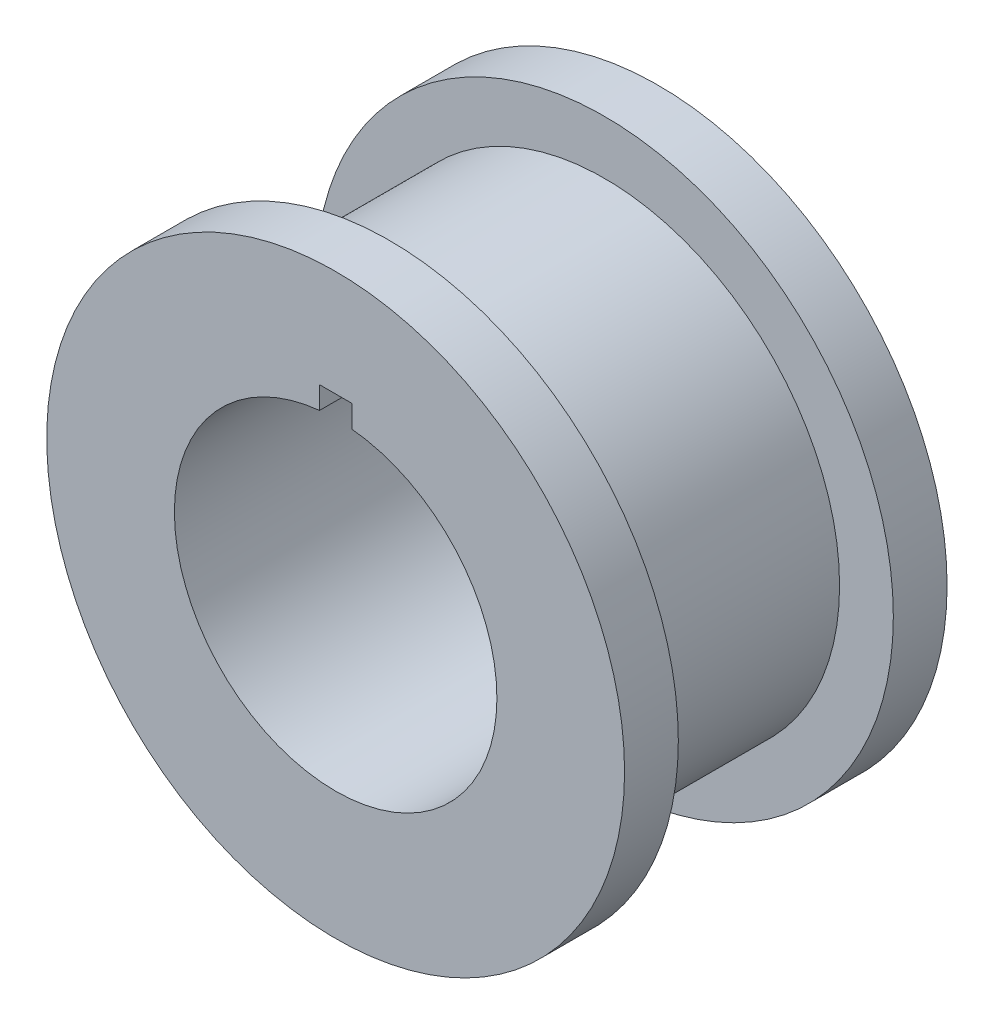
from build123d import *

# Parameters (mm, degrees)
SKETCH_1_R               = 21.875
EXTRUDE_1_DEPTH          = 15
PATTERN_CIRCULAR_1_COUNT = 20
SKETCH_3_R               = 15
CUT_EXTRUDE_1_DEPTH      = 44.09328544
CUT_EXTRUDE_4_DEPTH      = 35.380681349
CUT_EXTRUDE_4_DEPTH_BACK = 35.380681349
SKETCH_6_W               = 3
SKETCH_6_H               = 17
SKETCH_7_R               = 26.875
SKETCH_7_R_2             = 21.875
EXTRUDE_2_DEPTH          = 5


with BuildPart() as part:
    # 草图1 → 凸台-拉伸1 (new, symmetric)
    with BuildSketch(Plane.XY):
        Circle(SKETCH_1_R)
    extrude(amount=EXTRUDE_1_DEPTH, both=True)


with BuildPart() as pattern_circular_1_1:
    # 阵列(圆周)1: pattern copy
    add(part.part.rotate(Axis((0, 0, 15), (0, 0, 1)), 1 * 360 / PATTERN_CIRCULAR_1_COUNT))


with BuildPart() as pattern_circular_1_2:
    # 阵列(圆周)1: pattern copy
    add(part.part.rotate(Axis((0, 0, 15), (0, 0, 1)), 2 * 360 / PATTERN_CIRCULAR_1_COUNT))


with BuildPart() as pattern_circular_1_3:
    # 阵列(圆周)1: pattern copy
    add(part.part.rotate(Axis((0, 0, 15), (0, 0, 1)), 3 * 360 / PATTERN_CIRCULAR_1_COUNT))


with BuildPart() as pattern_circular_1_4:
    # 阵列(圆周)1: pattern copy
    add(part.part.rotate(Axis((0, 0, 15), (0, 0, 1)), 4 * 360 / PATTERN_CIRCULAR_1_COUNT))


with BuildPart() as pattern_circular_1_5:
    # 阵列(圆周)1: pattern copy
    add(part.part.rotate(Axis((0, 0, 15), (0, 0, 1)), 5 * 360 / PATTERN_CIRCULAR_1_COUNT))


with BuildPart() as pattern_circular_1_6:
    # 阵列(圆周)1: pattern copy
    add(part.part.rotate(Axis((0, 0, 15), (0, 0, 1)), 6 * 360 / PATTERN_CIRCULAR_1_COUNT))


with BuildPart() as pattern_circular_1_7:
    # 阵列(圆周)1: pattern copy
    add(part.part.rotate(Axis((0, 0, 15), (0, 0, 1)), 7 * 360 / PATTERN_CIRCULAR_1_COUNT))


with BuildPart() as pattern_circular_1_8:
    # 阵列(圆周)1: pattern copy
    add(part.part.rotate(Axis((0, 0, 15), (0, 0, 1)), 8 * 360 / PATTERN_CIRCULAR_1_COUNT))


with BuildPart() as pattern_circular_1_9:
    # 阵列(圆周)1: pattern copy
    add(part.part.rotate(Axis((0, 0, 15), (0, 0, 1)), 9 * 360 / PATTERN_CIRCULAR_1_COUNT))


with BuildPart() as pattern_circular_1_10:
    # 阵列(圆周)1: pattern copy
    add(part.part.rotate(Axis((0, 0, 15), (0, 0, 1)), 10 * 360 / PATTERN_CIRCULAR_1_COUNT))


with BuildPart() as pattern_circular_1_11:
    # 阵列(圆周)1: pattern copy
    add(part.part.rotate(Axis((0, 0, 15), (0, 0, 1)), 11 * 360 / PATTERN_CIRCULAR_1_COUNT))


with BuildPart() as pattern_circular_1_12:
    # 阵列(圆周)1: pattern copy
    add(part.part.rotate(Axis((0, 0, 15), (0, 0, 1)), 12 * 360 / PATTERN_CIRCULAR_1_COUNT))


with BuildPart() as pattern_circular_1_13:
    # 阵列(圆周)1: pattern copy
    add(part.part.rotate(Axis((0, 0, 15), (0, 0, 1)), 13 * 360 / PATTERN_CIRCULAR_1_COUNT))


with BuildPart() as pattern_circular_1_14:
    # 阵列(圆周)1: pattern copy
    add(part.part.rotate(Axis((0, 0, 15), (0, 0, 1)), 14 * 360 / PATTERN_CIRCULAR_1_COUNT))


with BuildPart() as pattern_circular_1_15:
    # 阵列(圆周)1: pattern copy
    add(part.part.rotate(Axis((0, 0, 15), (0, 0, 1)), 15 * 360 / PATTERN_CIRCULAR_1_COUNT))


with BuildPart() as pattern_circular_1_16:
    # 阵列(圆周)1: pattern copy
    add(part.part.rotate(Axis((0, 0, 15), (0, 0, 1)), 16 * 360 / PATTERN_CIRCULAR_1_COUNT))


with BuildPart() as pattern_circular_1_17:
    # 阵列(圆周)1: pattern copy
    add(part.part.rotate(Axis((0, 0, 15), (0, 0, 1)), 17 * 360 / PATTERN_CIRCULAR_1_COUNT))


with BuildPart() as pattern_circular_1_18:
    # 阵列(圆周)1: pattern copy
    add(part.part.rotate(Axis((0, 0, 15), (0, 0, 1)), 18 * 360 / PATTERN_CIRCULAR_1_COUNT))


with BuildPart() as pattern_circular_1_19:
    # 阵列(圆周)1: pattern copy
    add(part.part.rotate(Axis((0, 0, 15), (0, 0, 1)), 19 * 360 / PATTERN_CIRCULAR_1_COUNT))


with BuildPart() as cut_extrude_1_tool:
    # 草图3 → 切除-拉伸1 (new, through all)
    with BuildSketch(Plane.XY.offset(15)):
        Circle(SKETCH_3_R)
    extrude(amount=-CUT_EXTRUDE_1_DEPTH)


with BuildPart() as part_1:
    add(part.part)

    # 切除-拉伸1: cut by cut_extrude_1_tool
    add(cut_extrude_1_tool.part, mode=Mode.SUBTRACT)


with BuildPart() as pattern_circular_1_1_1:
    add(pattern_circular_1_1.part)

    # 切除-拉伸1: cut by cut_extrude_1_tool
    add(cut_extrude_1_tool.part, mode=Mode.SUBTRACT)


with BuildPart() as pattern_circular_1_2_1:
    add(pattern_circular_1_2.part)

    # 切除-拉伸1: cut by cut_extrude_1_tool
    add(cut_extrude_1_tool.part, mode=Mode.SUBTRACT)


with BuildPart() as pattern_circular_1_3_1:
    add(pattern_circular_1_3.part)

    # 切除-拉伸1: cut by cut_extrude_1_tool
    add(cut_extrude_1_tool.part, mode=Mode.SUBTRACT)


with BuildPart() as pattern_circular_1_4_1:
    add(pattern_circular_1_4.part)

    # 切除-拉伸1: cut by cut_extrude_1_tool
    add(cut_extrude_1_tool.part, mode=Mode.SUBTRACT)


with BuildPart() as pattern_circular_1_5_1:
    add(pattern_circular_1_5.part)

    # 切除-拉伸1: cut by cut_extrude_1_tool
    add(cut_extrude_1_tool.part, mode=Mode.SUBTRACT)


with BuildPart() as pattern_circular_1_6_1:
    add(pattern_circular_1_6.part)

    # 切除-拉伸1: cut by cut_extrude_1_tool
    add(cut_extrude_1_tool.part, mode=Mode.SUBTRACT)


with BuildPart() as pattern_circular_1_7_1:
    add(pattern_circular_1_7.part)

    # 切除-拉伸1: cut by cut_extrude_1_tool
    add(cut_extrude_1_tool.part, mode=Mode.SUBTRACT)


with BuildPart() as pattern_circular_1_8_1:
    add(pattern_circular_1_8.part)

    # 切除-拉伸1: cut by cut_extrude_1_tool
    add(cut_extrude_1_tool.part, mode=Mode.SUBTRACT)


with BuildPart() as pattern_circular_1_9_1:
    add(pattern_circular_1_9.part)

    # 切除-拉伸1: cut by cut_extrude_1_tool
    add(cut_extrude_1_tool.part, mode=Mode.SUBTRACT)


with BuildPart() as pattern_circular_1_10_1:
    add(pattern_circular_1_10.part)

    # 切除-拉伸1: cut by cut_extrude_1_tool
    add(cut_extrude_1_tool.part, mode=Mode.SUBTRACT)


with BuildPart() as pattern_circular_1_11_1:
    add(pattern_circular_1_11.part)

    # 切除-拉伸1: cut by cut_extrude_1_tool
    add(cut_extrude_1_tool.part, mode=Mode.SUBTRACT)


with BuildPart() as pattern_circular_1_12_1:
    add(pattern_circular_1_12.part)

    # 切除-拉伸1: cut by cut_extrude_1_tool
    add(cut_extrude_1_tool.part, mode=Mode.SUBTRACT)


with BuildPart() as pattern_circular_1_13_1:
    add(pattern_circular_1_13.part)

    # 切除-拉伸1: cut by cut_extrude_1_tool
    add(cut_extrude_1_tool.part, mode=Mode.SUBTRACT)


with BuildPart() as pattern_circular_1_14_1:
    add(pattern_circular_1_14.part)

    # 切除-拉伸1: cut by cut_extrude_1_tool
    add(cut_extrude_1_tool.part, mode=Mode.SUBTRACT)


with BuildPart() as pattern_circular_1_15_1:
    add(pattern_circular_1_15.part)

    # 切除-拉伸1: cut by cut_extrude_1_tool
    add(cut_extrude_1_tool.part, mode=Mode.SUBTRACT)


with BuildPart() as pattern_circular_1_16_1:
    add(pattern_circular_1_16.part)

    # 切除-拉伸1: cut by cut_extrude_1_tool
    add(cut_extrude_1_tool.part, mode=Mode.SUBTRACT)


with BuildPart() as pattern_circular_1_17_1:
    add(pattern_circular_1_17.part)

    # 切除-拉伸1: cut by cut_extrude_1_tool
    add(cut_extrude_1_tool.part, mode=Mode.SUBTRACT)


with BuildPart() as pattern_circular_1_18_1:
    add(pattern_circular_1_18.part)

    # 切除-拉伸1: cut by cut_extrude_1_tool
    add(cut_extrude_1_tool.part, mode=Mode.SUBTRACT)


with BuildPart() as pattern_circular_1_19_1:
    add(pattern_circular_1_19.part)

    # 切除-拉伸1: cut by cut_extrude_1_tool
    add(cut_extrude_1_tool.part, mode=Mode.SUBTRACT)


with BuildPart() as cut_extrude_4_tool:
    # 草图6 → 切除-拉伸4 (new, two sides: drawn at the far end of the back side and taken through both)
    with BuildSketch(Plane.XY.offset(-CUT_EXTRUDE_4_DEPTH_BACK)):
        with Locations((0, 8.5)):
            Rectangle(SKETCH_6_W, SKETCH_6_H)
    extrude(amount=CUT_EXTRUDE_4_DEPTH + CUT_EXTRUDE_4_DEPTH_BACK)


with BuildPart() as part_2:
    add(part_1.part)

    # 切除-拉伸4: cut by cut_extrude_4_tool
    add(cut_extrude_4_tool.part, mode=Mode.SUBTRACT)



with BuildPart() as pattern_circular_1_1_2:
    add(pattern_circular_1_1_1.part)

    # 切除-拉伸4: cut by cut_extrude_4_tool
    add(cut_extrude_4_tool.part, mode=Mode.SUBTRACT)


with BuildPart() as pattern_circular_1_2_2:
    add(pattern_circular_1_2_1.part)

    # 切除-拉伸4: cut by cut_extrude_4_tool
    add(cut_extrude_4_tool.part, mode=Mode.SUBTRACT)


with BuildPart() as pattern_circular_1_3_2:
    add(pattern_circular_1_3_1.part)

    # 切除-拉伸4: cut by cut_extrude_4_tool
    add(cut_extrude_4_tool.part, mode=Mode.SUBTRACT)


with BuildPart() as pattern_circular_1_4_2:
    add(pattern_circular_1_4_1.part)

    # 切除-拉伸4: cut by cut_extrude_4_tool
    add(cut_extrude_4_tool.part, mode=Mode.SUBTRACT)


with BuildPart() as pattern_circular_1_5_2:
    add(pattern_circular_1_5_1.part)

    # 切除-拉伸4: cut by cut_extrude_4_tool
    add(cut_extrude_4_tool.part, mode=Mode.SUBTRACT)


with BuildPart() as pattern_circular_1_6_2:
    add(pattern_circular_1_6_1.part)

    # 切除-拉伸4: cut by cut_extrude_4_tool
    add(cut_extrude_4_tool.part, mode=Mode.SUBTRACT)


with BuildPart() as pattern_circular_1_7_2:
    add(pattern_circular_1_7_1.part)

    # 切除-拉伸4: cut by cut_extrude_4_tool
    add(cut_extrude_4_tool.part, mode=Mode.SUBTRACT)


with BuildPart() as pattern_circular_1_8_2:
    add(pattern_circular_1_8_1.part)

    # 切除-拉伸4: cut by cut_extrude_4_tool
    add(cut_extrude_4_tool.part, mode=Mode.SUBTRACT)


with BuildPart() as pattern_circular_1_9_2:
    add(pattern_circular_1_9_1.part)

    # 切除-拉伸4: cut by cut_extrude_4_tool
    add(cut_extrude_4_tool.part, mode=Mode.SUBTRACT)


with BuildPart() as pattern_circular_1_10_2:
    add(pattern_circular_1_10_1.part)

    # 切除-拉伸4: cut by cut_extrude_4_tool
    add(cut_extrude_4_tool.part, mode=Mode.SUBTRACT)


with BuildPart() as pattern_circular_1_11_2:
    add(pattern_circular_1_11_1.part)

    # 切除-拉伸4: cut by cut_extrude_4_tool
    add(cut_extrude_4_tool.part, mode=Mode.SUBTRACT)


with BuildPart() as pattern_circular_1_12_2:
    add(pattern_circular_1_12_1.part)

    # 切除-拉伸4: cut by cut_extrude_4_tool
    add(cut_extrude_4_tool.part, mode=Mode.SUBTRACT)


with BuildPart() as pattern_circular_1_13_2:
    add(pattern_circular_1_13_1.part)

    # 切除-拉伸4: cut by cut_extrude_4_tool
    add(cut_extrude_4_tool.part, mode=Mode.SUBTRACT)


with BuildPart() as pattern_circular_1_14_2:
    add(pattern_circular_1_14_1.part)

    # 切除-拉伸4: cut by cut_extrude_4_tool
    add(cut_extrude_4_tool.part, mode=Mode.SUBTRACT)


with BuildPart() as pattern_circular_1_15_2:
    add(pattern_circular_1_15_1.part)

    # 切除-拉伸4: cut by cut_extrude_4_tool
    add(cut_extrude_4_tool.part, mode=Mode.SUBTRACT)


with BuildPart() as pattern_circular_1_16_2:
    add(pattern_circular_1_16_1.part)

    # 切除-拉伸4: cut by cut_extrude_4_tool
    add(cut_extrude_4_tool.part, mode=Mode.SUBTRACT)


with BuildPart() as pattern_circular_1_17_2:
    add(pattern_circular_1_17_1.part)

    # 切除-拉伸4: cut by cut_extrude_4_tool
    add(cut_extrude_4_tool.part, mode=Mode.SUBTRACT)


with BuildPart() as pattern_circular_1_18_2:
    add(pattern_circular_1_18_1.part)

    # 切除-拉伸4: cut by cut_extrude_4_tool
    add(cut_extrude_4_tool.part, mode=Mode.SUBTRACT)


with BuildPart() as pattern_circular_1_19_2:
    add(pattern_circular_1_19_1.part)

    # 切除-拉伸4: cut by cut_extrude_4_tool
    add(cut_extrude_4_tool.part, mode=Mode.SUBTRACT)


with BuildPart() as part_3:
    add(part_2.part)

    add(pattern_circular_1_1_2.part)  # 凸台-拉伸2 merges 阵列(圆周)1_1

    add(pattern_circular_1_2_2.part)  # 凸台-拉伸2 merges 阵列(圆周)1_2

    add(pattern_circular_1_3_2.part)  # 凸台-拉伸2 merges 阵列(圆周)1_3

    add(pattern_circular_1_4_2.part)  # 凸台-拉伸2 merges 阵列(圆周)1_4

    add(pattern_circular_1_5_2.part)  # 凸台-拉伸2 merges 阵列(圆周)1_5

    add(pattern_circular_1_6_2.part)  # 凸台-拉伸2 merges 阵列(圆周)1_6

    add(pattern_circular_1_7_2.part)  # 凸台-拉伸2 merges 阵列(圆周)1_7

    add(pattern_circular_1_8_2.part)  # 凸台-拉伸2 merges 阵列(圆周)1_8

    add(pattern_circular_1_9_2.part)  # 凸台-拉伸2 merges 阵列(圆周)1_9

    add(pattern_circular_1_10_2.part)  # 凸台-拉伸2 merges 阵列(圆周)1_10

    add(pattern_circular_1_11_2.part)  # 凸台-拉伸2 merges 阵列(圆周)1_11

    add(pattern_circular_1_12_2.part)  # 凸台-拉伸2 merges 阵列(圆周)1_12

    add(pattern_circular_1_13_2.part)  # 凸台-拉伸2 merges 阵列(圆周)1_13

    add(pattern_circular_1_14_2.part)  # 凸台-拉伸2 merges 阵列(圆周)1_14

    add(pattern_circular_1_15_2.part)  # 凸台-拉伸2 merges 阵列(圆周)1_15

    add(pattern_circular_1_16_2.part)  # 凸台-拉伸2 merges 阵列(圆周)1_16

    add(pattern_circular_1_17_2.part)  # 凸台-拉伸2 merges 阵列(圆周)1_17

    add(pattern_circular_1_18_2.part)  # 凸台-拉伸2 merges 阵列(圆周)1_18

    add(pattern_circular_1_19_2.part)  # 凸台-拉伸2 merges 阵列(圆周)1_19
    # 草图7 → 凸台-拉伸2 (add)
    with BuildSketch(Plane.XY.offset(15)):
        Circle(SKETCH_7_R)
        Circle(SKETCH_7_R_2, mode=Mode.SUBTRACT)
    extrude_2 = extrude(amount=-EXTRUDE_2_DEPTH)

    # 镜向1: 凸台-拉伸2 across plane
    add(extrude_2.mirror(Plane.XY))


solid = part_3.part
